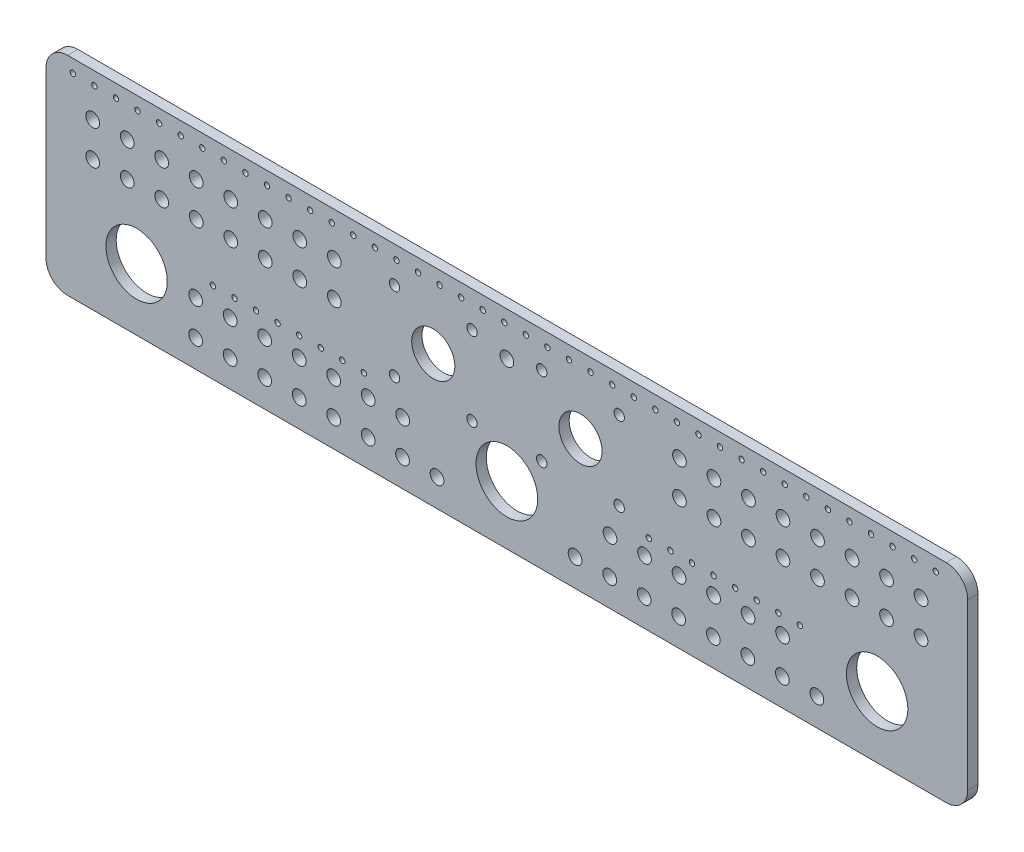
from build123d import *

# Parameters (mm, degrees)
SKETCH1_R           = 14.225
SKETCH1_R_2         = 14.3
SKETCH1_R_3         = 3.18
SKETCH1_R_4         = 1.25
SKETCH1_R_5         = 10
SKETCH1_R_6         = 2.413
BOSS_EXTRUDE5_DEPTH = 4.7625


with BuildPart() as part:
    # Sketch1 → Boss-Extrude5 (new body)
    with BuildSketch(Plane.XY):
        with BuildLine():
            Line((-426.349770336, 80.490429708), (-19.069770336, 80.490429708))
            ThreePointArc((-19.069770336, 80.490429708), (-11.998702525, 77.56149752), (-9.069770336, 70.490429708))
            Line((-9.069770336, 70.490429708), (-9.069770336, -5.909570292))
            ThreePointArc((-9.069770336, -5.909570292), (-11.998702525, -12.980638104), (-19.069770336, -15.909570292))
            Line((-19.069770336, -15.909570292), (-426.349770336, -15.909570292))
            ThreePointArc((-426.349770336, -15.909570292), (-433.420838148, -12.980638104), (-436.349770336, -5.909570292))
            Line((-436.349770336, -5.909570292), (-436.349770336, 70.490429708))
            ThreePointArc((-436.349770336, 70.490429708), (-433.420838148, 77.56149752), (-426.349770336, 80.490429708))
        make_face()
        with Locations(Location((-394.349770336, 12.790429708, 0), (0, 0, 180))):
            Circle(SKETCH1_R, mode=Mode.SUBTRACT)
        with Locations(Location((-51.069770336, 12.790429708, 0), (0, 0, 180))):
            Circle(SKETCH1_R, mode=Mode.SUBTRACT)
        with Locations(Location((-222.709770336, 11.290429708, 0), (0, 0, 180))):
            Circle(SKETCH1_R_2, mode=Mode.SUBTRACT)
        with Locations(Location((-174.899770336, 13.384511017, 0), (0, 0, 180))):
            Circle(SKETCH1_R_3, mode=Mode.SUBTRACT)
        with Locations(Location((-366.990768764, 12.790429708, 0), (0, 0, 180))):
            Circle(SKETCH1_R_3, mode=Mode.SUBTRACT)
        with Locations(Location((-358.995687615, 21.719099167, 0), (0, 0, 180))):
            Circle(SKETCH1_R_4, mode=Mode.SUBTRACT)
        with Locations(Location((-94.899770336, 13.384511017, 0), (0, 0, 180))):
            Circle(SKETCH1_R_3, mode=Mode.SUBTRACT)
        with Locations(Location((-366.990768764, -3.209570292, 0), (0, 0, 180))):
            Circle(SKETCH1_R_3, mode=Mode.SUBTRACT)
        with Locations(Location((-94.995687615, -3.209570292, 0), (0, 0, 180))):
            Circle(SKETCH1_R_3, mode=Mode.SUBTRACT)
        with Locations(Location((-110.995687615, -3.209570292, 0), (0, 0, 180))):
            Circle(SKETCH1_R_3, mode=Mode.SUBTRACT)
        with Locations(Location((-126.995687615, -3.209570292, 0), (0, 0, 180))):
            Circle(SKETCH1_R_3, mode=Mode.SUBTRACT)
        with Locations(Location((-78.995687615, -3.209570292, 0), (0, 0, 180))):
            Circle(SKETCH1_R_3, mode=Mode.SUBTRACT)
        with Locations(Location((-143.091604893, -3.209570292, 0), (0, 0, 180))):
            Circle(SKETCH1_R_3, mode=Mode.SUBTRACT)
        with Locations(Location((-159.091604893, -3.209570292, 0), (0, 0, 180))):
            Circle(SKETCH1_R_3, mode=Mode.SUBTRACT)
        with Locations(Location((-174.995687615, -3.209570292, 0), (0, 0, 180))):
            Circle(SKETCH1_R_3, mode=Mode.SUBTRACT)
        with Locations(Location((-96.899770336, 21.384511017, 0), (0, 0, 180))):
            Circle(SKETCH1_R_4, mode=Mode.SUBTRACT)
        with Locations(Location((-106.899770336, 21.384511017, 0), (0, 0, 180))):
            Circle(SKETCH1_R_4, mode=Mode.SUBTRACT)
        with Locations(Location((-350.990768764, 12.790429708, 0), (0, 0, 180))):
            Circle(SKETCH1_R_3, mode=Mode.SUBTRACT)
        with Locations(Location((-350.990768764, -3.209570292, 0), (0, 0, 180))):
            Circle(SKETCH1_R_3, mode=Mode.SUBTRACT)
        with Locations(Location((-334.990768764, 12.790429708, 0), (0, 0, 180))):
            Circle(SKETCH1_R_3, mode=Mode.SUBTRACT)
        with Locations(Location((-334.990768764, -3.209570292, 0), (0, 0, 180))):
            Circle(SKETCH1_R_3, mode=Mode.SUBTRACT)
        with Locations(Location((-318.990768764, 12.790429708, 0), (0, 0, 180))):
            Circle(SKETCH1_R_3, mode=Mode.SUBTRACT)
        with Locations(Location((-318.990768764, -3.209570292, 0), (0, 0, 180))):
            Circle(SKETCH1_R_3, mode=Mode.SUBTRACT)
        with Locations(Location((-302.990768764, 12.790429708, 0), (0, 0, 180))):
            Circle(SKETCH1_R_3, mode=Mode.SUBTRACT)
        with Locations(Location((-302.990768764, -3.209570292, 0), (0, 0, 180))):
            Circle(SKETCH1_R_3, mode=Mode.SUBTRACT)
        with Locations(Location((-286.990768764, 12.790429708, 0), (0, 0, 180))):
            Circle(SKETCH1_R_3, mode=Mode.SUBTRACT)
        with Locations(Location((-286.990768764, -3.209570292, 0), (0, 0, 180))):
            Circle(SKETCH1_R_3, mode=Mode.SUBTRACT)
        with Locations(Location((-158.899770336, 13.384511017, 0), (0, 0, 180))):
            Circle(SKETCH1_R_3, mode=Mode.SUBTRACT)
        with Locations(Location((-142.899770336, 13.384511017, 0), (0, 0, 180))):
            Circle(SKETCH1_R_3, mode=Mode.SUBTRACT)
        with Locations(Location((-126.899770336, 13.384511017, 0), (0, 0, 180))):
            Circle(SKETCH1_R_3, mode=Mode.SUBTRACT)
        with Locations(Location((-110.899770336, 13.384511017, 0), (0, 0, 180))):
            Circle(SKETCH1_R_3, mode=Mode.SUBTRACT)
        with Locations(Location((-86.899770336, 21.384511017, 0), (0, 0, 180))):
            Circle(SKETCH1_R_4, mode=Mode.SUBTRACT)
        with Locations(Location((-270.990768764, 12.790429708, 0), (0, 0, 180))):
            Circle(SKETCH1_R_3, mode=Mode.SUBTRACT)
        with Locations(Location((-348.995687615, 21.719099167, 0), (0, 0, 180))):
            Circle(SKETCH1_R_4, mode=Mode.SUBTRACT)
        with Locations(Location((-116.899770336, 21.384511017, 0), (0, 0, 180))):
            Circle(SKETCH1_R_4, mode=Mode.SUBTRACT)
        with Locations(Location((-338.995687615, 21.719099167, 0), (0, 0, 180))):
            Circle(SKETCH1_R_4, mode=Mode.SUBTRACT)
        with Locations(Location((-328.995687615, 21.719099167, 0), (0, 0, 180))):
            Circle(SKETCH1_R_4, mode=Mode.SUBTRACT)
        with Locations(Location((-318.995687615, 21.719099167, 0), (0, 0, 180))):
            Circle(SKETCH1_R_4, mode=Mode.SUBTRACT)
        with Locations(Location((-308.995687615, 21.719099167, 0), (0, 0, 180))):
            Circle(SKETCH1_R_4, mode=Mode.SUBTRACT)
        with Locations(Location((-298.995687615, 21.719099167, 0), (0, 0, 180))):
            Circle(SKETCH1_R_4, mode=Mode.SUBTRACT)
        with Locations(Location((-288.995687615, 21.719099167, 0), (0, 0, 180))):
            Circle(SKETCH1_R_4, mode=Mode.SUBTRACT)
        with Locations(Location((-126.899770336, 21.384511017, 0), (0, 0, 180))):
            Circle(SKETCH1_R_4, mode=Mode.SUBTRACT)
        with Locations(Location((-136.899770336, 21.384511017, 0), (0, 0, 180))):
            Circle(SKETCH1_R_4, mode=Mode.SUBTRACT)
        with Locations(Location((-146.899770336, 21.384511017, 0), (0, 0, 180))):
            Circle(SKETCH1_R_4, mode=Mode.SUBTRACT)
        with Locations(Location((-156.899770336, 21.384511017, 0), (0, 0, 180))):
            Circle(SKETCH1_R_4, mode=Mode.SUBTRACT)
        with Locations(Location((-213.909770336, 74.490429708, 0), (0, 0, 180))):
            Circle(SKETCH1_R_4, mode=Mode.SUBTRACT)
        with Locations(Location((-30.709770336, 60.490429708, 0), (0, 0, 180))):
            Circle(SKETCH1_R_3, mode=Mode.SUBTRACT)
        with Locations(Location((-414.709770336, 60.490429708, 0), (0, 0, 180))):
            Circle(SKETCH1_R_3, mode=Mode.SUBTRACT)
        with Locations(Location((-203.909770336, 74.490429708, 0), (0, 0, 180))):
            Circle(SKETCH1_R_4, mode=Mode.SUBTRACT)
        with Locations(Location((-193.909770336, 74.490429708, 0), (0, 0, 180))):
            Circle(SKETCH1_R_4, mode=Mode.SUBTRACT)
        with Locations(Location((-183.909770336, 74.490429708, 0), (0, 0, 180))):
            Circle(SKETCH1_R_4, mode=Mode.SUBTRACT)
        with Locations(Location((-173.909770336, 74.490429708, 0), (0, 0, 180))):
            Circle(SKETCH1_R_4, mode=Mode.SUBTRACT)
        with Locations(Location((-163.909770336, 74.490429708, 0), (0, 0, 180))):
            Circle(SKETCH1_R_4, mode=Mode.SUBTRACT)
        with Locations(Location((-153.909770336, 74.490429708, 0), (0, 0, 180))):
            Circle(SKETCH1_R_4, mode=Mode.SUBTRACT)
        with Locations(Location((-143.909770336, 74.490429708, 0), (0, 0, 180))):
            Circle(SKETCH1_R_4, mode=Mode.SUBTRACT)
        with Locations(Location((-133.909770336, 74.490429708, 0), (0, 0, 180))):
            Circle(SKETCH1_R_4, mode=Mode.SUBTRACT)
        with Locations(Location((-123.909770336, 74.490429708, 0), (0, 0, 180))):
            Circle(SKETCH1_R_4, mode=Mode.SUBTRACT)
        with Locations(Location((-113.909770336, 74.490429708, 0), (0, 0, 180))):
            Circle(SKETCH1_R_4, mode=Mode.SUBTRACT)
        with Locations(Location((-103.909770336, 74.490429708, 0), (0, 0, 180))):
            Circle(SKETCH1_R_4, mode=Mode.SUBTRACT)
        with Locations(Location((-93.909770336, 74.490429708, 0), (0, 0, 180))):
            Circle(SKETCH1_R_4, mode=Mode.SUBTRACT)
        with Locations(Location((-83.909770336, 74.490429708, 0), (0, 0, 180))):
            Circle(SKETCH1_R_4, mode=Mode.SUBTRACT)
        with Locations(Location((-73.909770336, 74.490429708, 0), (0, 0, 180))):
            Circle(SKETCH1_R_4, mode=Mode.SUBTRACT)
        with Locations(Location((-63.909770336, 74.490429708, 0), (0, 0, 180))):
            Circle(SKETCH1_R_4, mode=Mode.SUBTRACT)
        with Locations(Location((-53.909770336, 74.490429708, 0), (0, 0, 180))):
            Circle(SKETCH1_R_4, mode=Mode.SUBTRACT)
        with Locations(Location((-43.909770336, 74.490429708, 0), (0, 0, 180))):
            Circle(SKETCH1_R_4, mode=Mode.SUBTRACT)
        with Locations(Location((-33.909770336, 74.490429708, 0), (0, 0, 180))):
            Circle(SKETCH1_R_4, mode=Mode.SUBTRACT)
        with Locations(Location((-23.909770336, 74.490429708, 0), (0, 0, 180))):
            Circle(SKETCH1_R_4, mode=Mode.SUBTRACT)
        with Locations(Location((-223.909770336, 74.490429708, 0), (0, 0, 180))):
            Circle(SKETCH1_R_4, mode=Mode.SUBTRACT)
        with Locations(Location((-233.909770336, 74.490429708, 0), (0, 0, 180))):
            Circle(SKETCH1_R_4, mode=Mode.SUBTRACT)
        with Locations(Location((-243.909770336, 74.490429708, 0), (0, 0, 180))):
            Circle(SKETCH1_R_4, mode=Mode.SUBTRACT)
        with Locations(Location((-253.909770336, 74.490429708, 0), (0, 0, 180))):
            Circle(SKETCH1_R_4, mode=Mode.SUBTRACT)
        with Locations(Location((-263.909770336, 74.490429708, 0), (0, 0, 180))):
            Circle(SKETCH1_R_4, mode=Mode.SUBTRACT)
        with Locations(Location((-273.909770336, 74.490429708, 0), (0, 0, 180))):
            Circle(SKETCH1_R_4, mode=Mode.SUBTRACT)
        with Locations(Location((-283.909770336, 74.490429708, 0), (0, 0, 180))):
            Circle(SKETCH1_R_4, mode=Mode.SUBTRACT)
        with Locations(Location((-293.909770336, 74.490429708, 0), (0, 0, 180))):
            Circle(SKETCH1_R_4, mode=Mode.SUBTRACT)
        with Locations(Location((-303.909770336, 74.490429708, 0), (0, 0, 180))):
            Circle(SKETCH1_R_4, mode=Mode.SUBTRACT)
        with Locations(Location((-313.909770336, 74.490429708, 0), (0, 0, 180))):
            Circle(SKETCH1_R_4, mode=Mode.SUBTRACT)
        with Locations(Location((-323.909770336, 74.490429708, 0), (0, 0, 180))):
            Circle(SKETCH1_R_4, mode=Mode.SUBTRACT)
        with Locations(Location((-333.909770336, 74.490429708, 0), (0, 0, 180))):
            Circle(SKETCH1_R_4, mode=Mode.SUBTRACT)
        with Locations(Location((-343.909770336, 74.490429708, 0), (0, 0, 180))):
            Circle(SKETCH1_R_4, mode=Mode.SUBTRACT)
        with Locations(Location((-353.909770336, 74.490429708, 0), (0, 0, 180))):
            Circle(SKETCH1_R_4, mode=Mode.SUBTRACT)
        with Locations(Location((-363.909770336, 74.490429708, 0), (0, 0, 180))):
            Circle(SKETCH1_R_4, mode=Mode.SUBTRACT)
        with Locations(Location((-373.909770336, 74.490429708, 0), (0, 0, 180))):
            Circle(SKETCH1_R_4, mode=Mode.SUBTRACT)
        with Locations(Location((-383.909770336, 74.490429708, 0), (0, 0, 180))):
            Circle(SKETCH1_R_4, mode=Mode.SUBTRACT)
        with Locations(Location((-393.909770336, 74.490429708, 0), (0, 0, 180))):
            Circle(SKETCH1_R_4, mode=Mode.SUBTRACT)
        with Locations(Location((-403.909770336, 74.490429708, 0), (0, 0, 180))):
            Circle(SKETCH1_R_4, mode=Mode.SUBTRACT)
        with Locations(Location((-413.909770336, 74.490429708, 0), (0, 0, 180))):
            Circle(SKETCH1_R_4, mode=Mode.SUBTRACT)
        with Locations(Location((-191.091604893, -3.209570292, 0), (0, 0, 180))):
            Circle(SKETCH1_R_3, mode=Mode.SUBTRACT)
        with Locations(Location((-255.091604893, -3.209570292, 0), (0, 0, 180))):
            Circle(SKETCH1_R_3, mode=Mode.SUBTRACT)
        with Locations(Location((-423.909770336, 74.490429708, 0), (0, 0, 180))):
            Circle(SKETCH1_R_4, mode=Mode.SUBTRACT)
        with Locations(Location((-222.709770336, 60.490429708, 0), (0, 0, 180))):
            Circle(SKETCH1_R_3, mode=Mode.SUBTRACT)
        with Locations(Location((-271.091604893, -3.209570292, 0), (0, 0, 180))):
            Circle(SKETCH1_R_3, mode=Mode.SUBTRACT)
        with Locations(Location((-256.829770336, 45.410429708, 0), (0, 0, 180))):
            Circle(SKETCH1_R_5, mode=Mode.SUBTRACT)
        with Locations(Location((-274.790282579, 27.449917466, 0), (0, 0, 180))):
            Circle(SKETCH1_R_6, mode=Mode.SUBTRACT)
        with Locations(Location((-238.869258094, 27.449917466, 0), (0, 0, 180))):
            Circle(SKETCH1_R_6, mode=Mode.SUBTRACT)
        with Locations(Location((-274.790282579, 63.96502326, 0), (0, 0, 180))):
            Circle(SKETCH1_R_6, mode=Mode.SUBTRACT)
        with Locations(Location((-238.869258094, 63.96502326, 0), (0, 0, 180))):
            Circle(SKETCH1_R_6, mode=Mode.SUBTRACT)
        with Locations(Location((-188.589770336, 45.410429708, 0), (0, 0, 180))):
            Circle(SKETCH1_R_5, mode=Mode.SUBTRACT)
        with Locations(Location((-206.550282579, 63.96502326, 0), (0, 0, 180))):
            Circle(SKETCH1_R_6, mode=Mode.SUBTRACT)
        with Locations(Location((-170.629258094, 63.96502326, 0), (0, 0, 180))):
            Circle(SKETCH1_R_6, mode=Mode.SUBTRACT)
        with Locations(Location((-170.629258094, 27.449917466, 0), (0, 0, 180))):
            Circle(SKETCH1_R_6, mode=Mode.SUBTRACT)
        with Locations(Location((-206.550282579, 27.449917466, 0), (0, 0, 180))):
            Circle(SKETCH1_R_6, mode=Mode.SUBTRACT)
        with Locations(Location((-398.709770336, 60.490429708, 0), (0, 0, 180))):
            Circle(SKETCH1_R_3, mode=Mode.SUBTRACT)
        with Locations(Location((-382.709770336, 60.490429708, 0), (0, 0, 180))):
            Circle(SKETCH1_R_3, mode=Mode.SUBTRACT)
        with Locations(Location((-366.709770336, 60.490429708, 0), (0, 0, 180))):
            Circle(SKETCH1_R_3, mode=Mode.SUBTRACT)
        with Locations(Location((-350.709770336, 60.490429708, 0), (0, 0, 180))):
            Circle(SKETCH1_R_3, mode=Mode.SUBTRACT)
        with Locations(Location((-334.709770336, 60.490429708, 0), (0, 0, 180))):
            Circle(SKETCH1_R_3, mode=Mode.SUBTRACT)
        with Locations(Location((-318.709770336, 60.490429708, 0), (0, 0, 180))):
            Circle(SKETCH1_R_3, mode=Mode.SUBTRACT)
        with Locations(Location((-302.709770336, 60.490429708, 0), (0, 0, 180))):
            Circle(SKETCH1_R_3, mode=Mode.SUBTRACT)
        with Locations(Location((-398.709770336, 44.490429708, 0), (0, 0, 180))):
            Circle(SKETCH1_R_3, mode=Mode.SUBTRACT)
        with Locations(Location((-382.709770336, 44.490429708, 0), (0, 0, 180))):
            Circle(SKETCH1_R_3, mode=Mode.SUBTRACT)
        with Locations(Location((-366.709770336, 44.490429708, 0), (0, 0, 180))):
            Circle(SKETCH1_R_3, mode=Mode.SUBTRACT)
        with Locations(Location((-350.709770336, 44.490429708, 0), (0, 0, 180))):
            Circle(SKETCH1_R_3, mode=Mode.SUBTRACT)
        with Locations(Location((-334.709770336, 44.490429708, 0), (0, 0, 180))):
            Circle(SKETCH1_R_3, mode=Mode.SUBTRACT)
        with Locations(Location((-318.709770336, 44.490429708, 0), (0, 0, 180))):
            Circle(SKETCH1_R_3, mode=Mode.SUBTRACT)
        with Locations(Location((-302.709770336, 44.490429708, 0), (0, 0, 180))):
            Circle(SKETCH1_R_3, mode=Mode.SUBTRACT)
        with Locations(Location((-414.709770336, 44.490429708, 0), (0, 0, 180))):
            Circle(SKETCH1_R_3, mode=Mode.SUBTRACT)
        with Locations(Location((-46.709770336, 60.490429708, 0), (0, 0, 180))):
            Circle(SKETCH1_R_3, mode=Mode.SUBTRACT)
        with Locations(Location((-62.709770336, 60.490429708, 0), (0, 0, 180))):
            Circle(SKETCH1_R_3, mode=Mode.SUBTRACT)
        with Locations(Location((-78.709770336, 60.490429708, 0), (0, 0, 180))):
            Circle(SKETCH1_R_3, mode=Mode.SUBTRACT)
        with Locations(Location((-94.709770336, 60.490429708, 0), (0, 0, 180))):
            Circle(SKETCH1_R_3, mode=Mode.SUBTRACT)
        with Locations(Location((-110.709770336, 60.490429708, 0), (0, 0, 180))):
            Circle(SKETCH1_R_3, mode=Mode.SUBTRACT)
        with Locations(Location((-126.709770336, 60.490429708, 0), (0, 0, 180))):
            Circle(SKETCH1_R_3, mode=Mode.SUBTRACT)
        with Locations(Location((-142.709770336, 60.490429708, 0), (0, 0, 180))):
            Circle(SKETCH1_R_3, mode=Mode.SUBTRACT)
        with Locations(Location((-46.709770336, 44.490429708, 0), (0, 0, 180))):
            Circle(SKETCH1_R_3, mode=Mode.SUBTRACT)
        with Locations(Location((-62.709770336, 44.490429708, 0), (0, 0, 180))):
            Circle(SKETCH1_R_3, mode=Mode.SUBTRACT)
        with Locations(Location((-78.709770336, 44.490429708, 0), (0, 0, 180))):
            Circle(SKETCH1_R_3, mode=Mode.SUBTRACT)
        with Locations(Location((-94.709770336, 44.490429708, 0), (0, 0, 180))):
            Circle(SKETCH1_R_3, mode=Mode.SUBTRACT)
        with Locations(Location((-110.709770336, 44.490429708, 0), (0, 0, 180))):
            Circle(SKETCH1_R_3, mode=Mode.SUBTRACT)
        with Locations(Location((-126.709770336, 44.490429708, 0), (0, 0, 180))):
            Circle(SKETCH1_R_3, mode=Mode.SUBTRACT)
        with Locations(Location((-142.709770336, 44.490429708, 0), (0, 0, 180))):
            Circle(SKETCH1_R_3, mode=Mode.SUBTRACT)
        with Locations(Location((-30.709770336, 44.490429708, 0), (0, 0, 180))):
            Circle(SKETCH1_R_3, mode=Mode.SUBTRACT)
    extrude(amount=BOSS_EXTRUDE5_DEPTH)


solid = part.part
